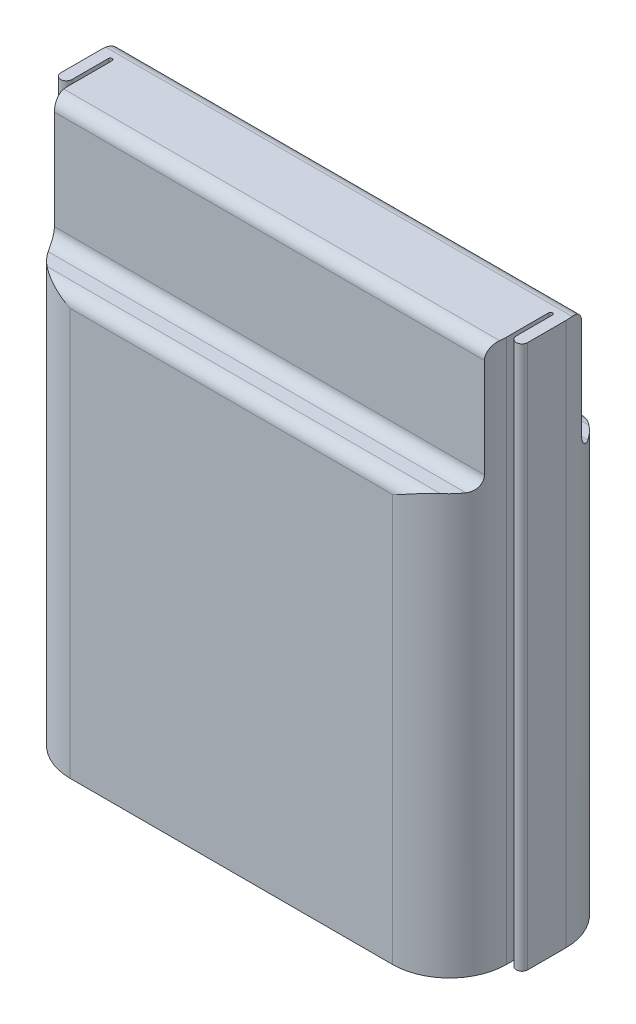
from build123d import *

# Parameters (mm, degrees)
EXTRUDE_1_DEPTH     = 14.25
CUT_EXTRUDE_START   = -12.229513
CUT_EXTRUDE_1_DEPTH = 24.459026


with BuildPart() as part:
    # Эскиз1 → Бобышка-Вытянуть1 (new, symmetric)
    with BuildSketch(Plane(origin=(0, 0, 0), x_dir=(1, 0, 0), z_dir=(0, 1, 0))):
        with BuildLine():
            Line((-9.25, 0), (9.25, 0))
            ThreePointArc((9.25, 0), (11.371320344, -0.878679656), (12.25, -3))
            Line((12.25, -3), (12.25, -5))
            ThreePointArc((12.25, -5), (11.95, -5.3), (11.65, -5))
            Line((11.65, -5), (11.65, -3.1))
            ThreePointArc((11.65, -3.1), (11.55, -3), (11.45, -3.1))
            Line((11.45, -3.1), (11.45, -5.3))
            ThreePointArc((11.45, -5.3), (10.571320344, -7.421320344), (8.45, -8.3))
            Line((8.45, -8.3), (-8.45, -8.3))
            ThreePointArc((-8.45, -8.3), (-10.571320344, -7.421320344), (-11.45, -5.3))
            Line((-11.45, -5.3), (-11.45, -3.1))
            ThreePointArc((-11.45, -3.1), (-11.55, -3), (-11.65, -3.1))
            Line((-11.65, -3.1), (-11.65, -5))
            ThreePointArc((-11.65, -5), (-11.95, -5.3), (-12.25, -5))
            Line((-12.25, -5), (-12.25, -3))
            ThreePointArc((-12.25, -3), (-11.371320344, -0.878679656), (-9.25, 0))
        make_face()
    extrude(amount=EXTRUDE_1_DEPTH, both=True)

    # Эскиз2 → Вырез-Вытянуть1 (cut)
    with BuildSketch(Plane(origin=(0, 0, 0), x_dir=(0, 0, -1), z_dir=(1, 0, 0)).offset(CUT_EXTRUDE_START)):
        with BuildLine():
            Line((-6.3, 13.6), (-6.3, 8.4))
            ThreePointArc((-6.3, 8.4), (-6.490380592, 7.940380592), (-6.95, 7.75))
            Line((-6.95, 7.75), (-7.65, 7.75))
            ThreePointArc((-7.65, 7.75), (-8.109619408, 7.559619408), (-8.3, 7.1))
            Line((-8.3, 7.1), (-8.3, 14.25))
            Line((-8.3, 14.25), (-8.3, 15.25))
            Line((-8.3, 15.25), (0, 15.25))
            Line((0, 15.25), (0, 7.1))
            ThreePointArc((0, 7.1), (-0.190380592, 7.559619408), (-0.65, 7.75))
            Line((-0.65, 7.75), (-1.35, 7.75))
            ThreePointArc((-1.35, 7.75), (-1.809619408, 7.940380592), (-2, 8.4))
            Line((-2, 8.4), (-2, 13.6))
            ThreePointArc((-2, 13.6), (-2.190380592, 14.059619408), (-2.65, 14.25))
            Line((-2.65, 14.25), (-5.65, 14.25))
            ThreePointArc((-5.65, 14.25), (-6.109619408, 14.059619408), (-6.3, 13.6))
        make_face()
    extrude(amount=CUT_EXTRUDE_1_DEPTH, mode=Mode.SUBTRACT)


solid = part.part
